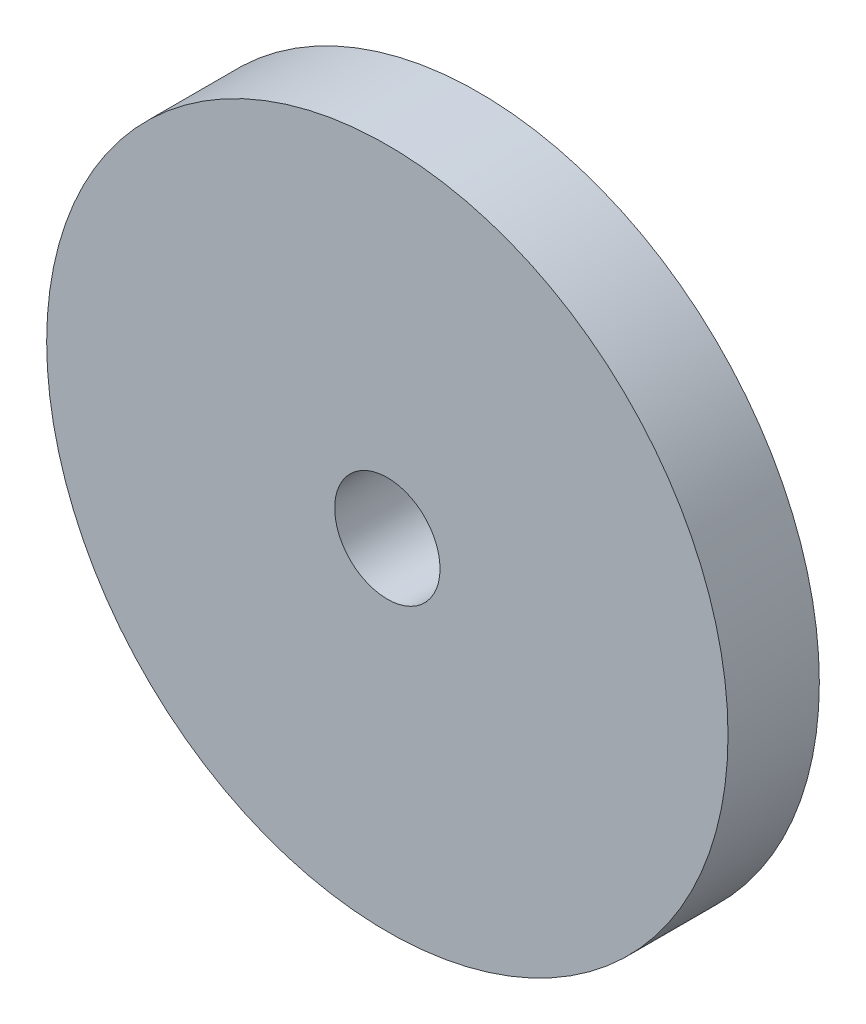
from build123d import *


with BuildPart() as part:
    # Эскиз1 → Повернуть1 (revolve)
    with BuildSketch(Plane(origin=(0, 0, 0), x_dir=(1, 0, 0), z_dir=(0, 1, 0))):
        Polygon((5, 0), (5, 1), (3.75, 1), (3.75, -6.5), (24.25, -6.5), (24.25, 0), align=None)
    revolve(axis=Axis((0, 0, -1), (0, 0, 1)))


solid = part.part
